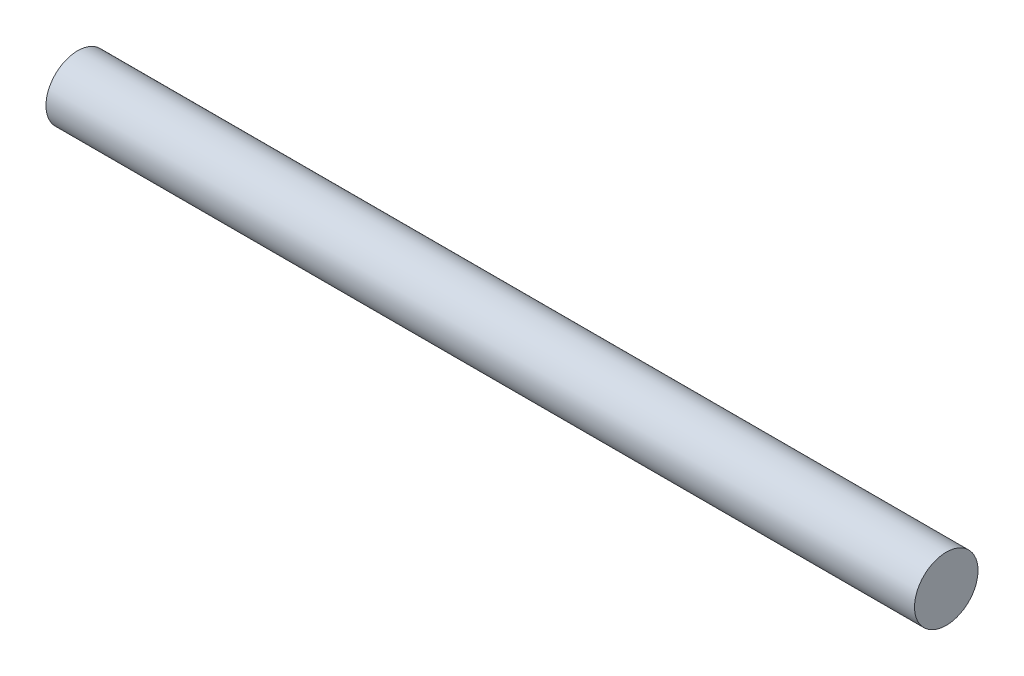
from build123d import *

# Parameters (mm, degrees)
SKETCH1_R                    = 11.11
BOSS_EXTRUDE1_DEPTH          = 304
F_3_0_3_DIAMETER_HOLE2_D     = 3
F_3_0_3_DIAMETER_HOLE2_DEPTH = 11
F_3_0_3_DIAMETER_HOLE2_TIP   = 0.901290929


with BuildPart() as part:
    # Sketch1 → Boss-Extrude1 (new body)
    with BuildSketch(Plane(origin=(0, 0, 0), x_dir=(0, 0, -1), z_dir=(1, 0, 0))):
        Circle(SKETCH1_R)
    extrude(amount=BOSS_EXTRUDE1_DEPTH)

    # Ø3.0 (3) Diameter Hole2
    with Locations(Plane.ZY):
        with Locations((0, 5.3)):
            Hole(F_3_0_3_DIAMETER_HOLE2_D / 2, depth=F_3_0_3_DIAMETER_HOLE2_DEPTH)
            with Locations((0, 0, -(F_3_0_3_DIAMETER_HOLE2_DEPTH + F_3_0_3_DIAMETER_HOLE2_TIP / 2))):  # 118° drill point
                Cone(0, F_3_0_3_DIAMETER_HOLE2_D / 2, F_3_0_3_DIAMETER_HOLE2_TIP, mode=Mode.SUBTRACT)


solid = part.part
